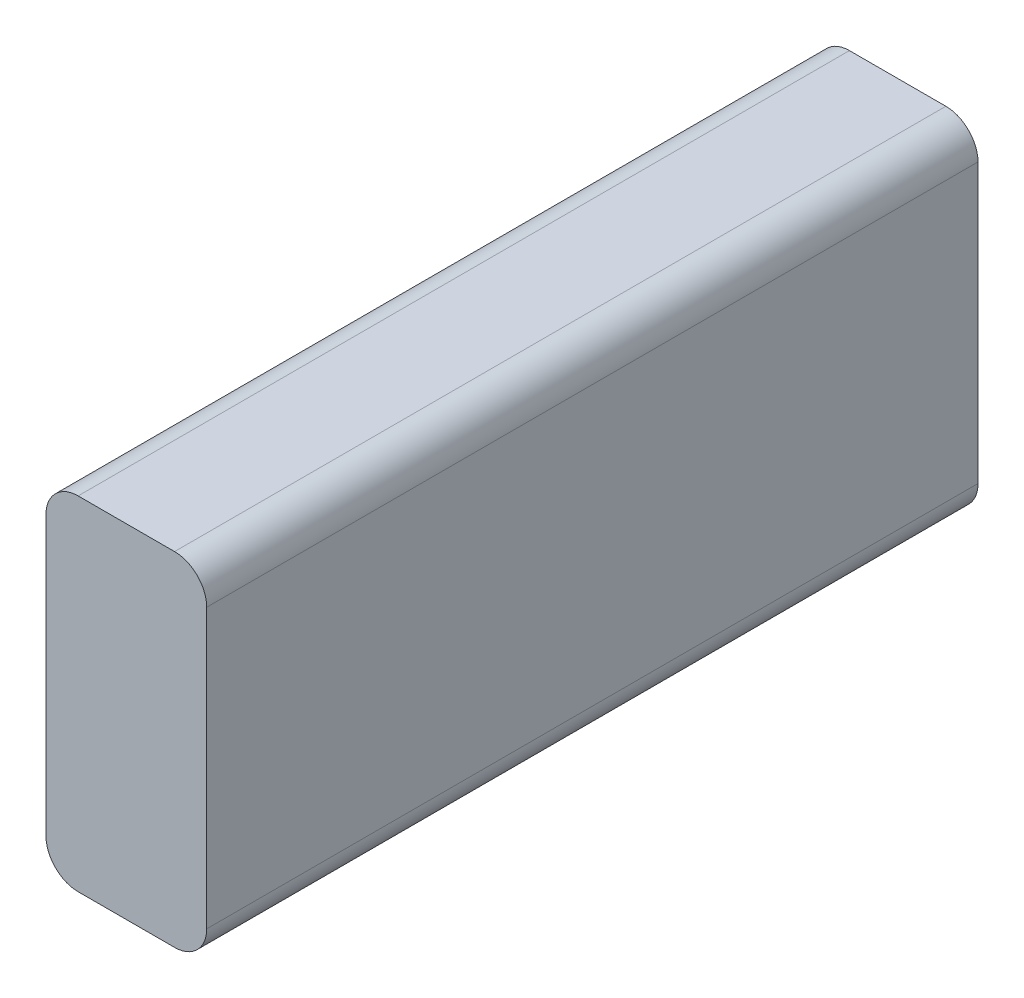
from build123d import *

# Parameters (mm, degrees)
SKETCH1_W           = 381
SKETCH1_H           = 812.8
BOSS_EXTRUDE1_DEPTH = 1828.8
FILLET1_R           = 76.2


with BuildPart() as part:
    # Sketch1 → Boss-Extrude1 (new body)
    with BuildSketch(Plane.XY):
        Rectangle(SKETCH1_W, SKETCH1_H)
    extrude(amount=BOSS_EXTRUDE1_DEPTH)

    # Fillet1
    fillet1_edges = [part.edges().sort_by_distance(p)[0] for p in [
        (-190.5, 406.4, 914.4),
        (190.5, 406.4, 914.4),
        (190.5, -406.4, 914.4),
        (-190.5, -406.4, 914.4),
    ]]
    fillet(fillet1_edges, radius=FILLET1_R)


solid = part.part
